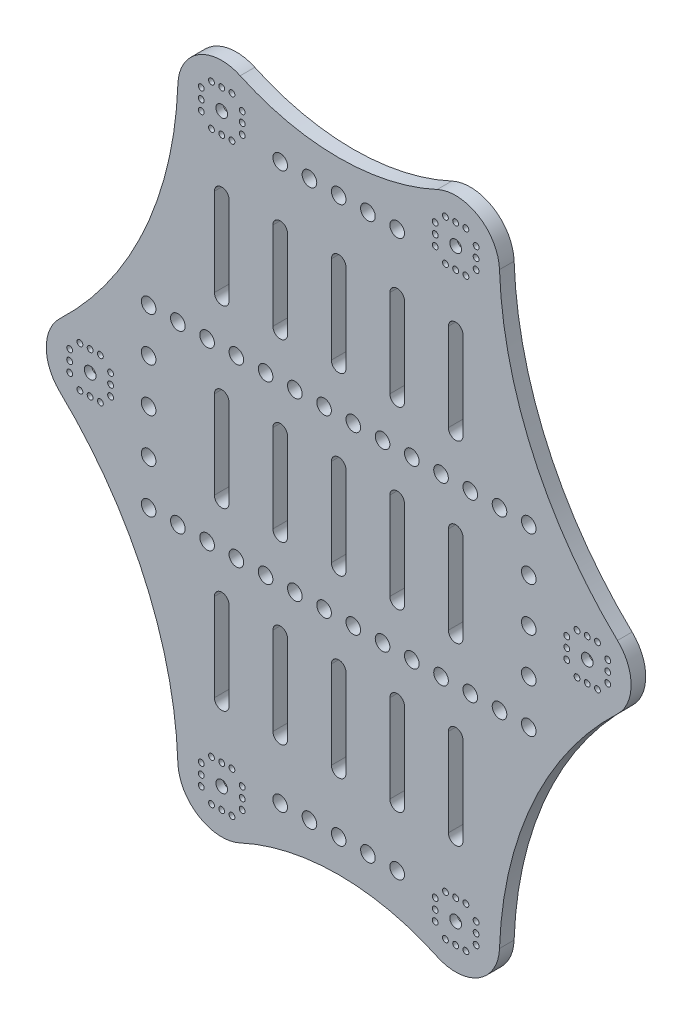
from build123d import *

# Parameters (mm, degrees)
BOSS_EXTRUDE1_DEPTH       = 5
SKETCH2_R                 = 11.25
CUT_EXTRUDE1_DEPTH        = 2.5
SKETCH3_R                 = 1
SKETCH3_R_2               = 2
CUT_EXTRUDE2_DEPTH        = 2.5
MIRROR2_COPY_1_SKETCH_R   = 1
MIRROR2_COPY_1_SKETCH_R_2 = 2
MIRROR2_COPY_1_DEPTH      = 2.5
SKETCH5_R                 = 2.5
CUT_EXTRUDE4_DEPTH        = 12.5
CUT_EXTRUDE6_DEPTH        = 10
SKETCH9_R                 = 2.5
CUT_EXTRUDE7_DEPTH        = 10
SKETCH10_R                = 2.5
CUT_EXTRUDE8_DEPTH        = 10


with BuildPart() as part:
    # Sketch1 → Boss-Extrude1 (new body)
    with BuildSketch(Plane.XY):
        with BuildLine():
            ThreePointArc((95.335601491, -10.870848257), (100, 0), (95.335601491, 10.870848257))
            ThreePointArc((95.335601491, 10.870848257), (66.361018737, 51.737458432), (54.990773904, 100.526020671))
            ThreePointArc((54.990773904, 100.526020671), (47.847440062, 112.783492655), (33.684210526, 113.60554311))
            ThreePointArc((33.684210526, 113.60554311), (0, 106.168439698), (-33.684210526, 113.60554311))
            ThreePointArc((-33.684210526, 113.60554311), (-47.847440062, 112.783492655), (-54.990773904, 100.526020671))
            ThreePointArc((-54.990773904, 100.526020671), (-66.361018737, 51.737458432), (-95.335601491, 10.870848257))
            ThreePointArc((-95.335601491, 10.870848257), (-100, 0), (-95.335601491, -10.870848257))
            ThreePointArc((-95.335601491, -10.870848257), (-66.361018737, -51.737458432), (-54.990773904, -100.526020671))
            ThreePointArc((-54.990773904, -100.526020671), (-47.847440062, -112.783492655), (-33.684210526, -113.60554311))
            ThreePointArc((-33.684210526, -113.60554311), (0, -106.168439698), (33.684210526, -113.60554311))
            ThreePointArc((33.684210526, -113.60554311), (47.847440062, -112.783492655), (54.990773904, -100.526020671))
            ThreePointArc((54.990773904, -100.526020671), (66.361018737, -51.737458432), (95.335601491, -10.870848257))
        make_face()
    extrude(amount=BOSS_EXTRUDE1_DEPTH)

    # Sketch2 → Cut-Extrude1 (cut)
    with BuildSketch(Plane(origin=(0, 0, 0), x_dir=(-1, 0, 0), z_dir=(0, 0, -1))):
        with Locations((-40, 100)):
            Circle(SKETCH2_R)
        with Locations((-85, 0)):
            Circle(SKETCH2_R)
        with Locations((85, 0)):
            Circle(SKETCH2_R)
        with Locations((40, 100)):
            Circle(SKETCH2_R)
        with Locations((40, -100)):
            Circle(SKETCH2_R)
        with Locations((-40, -100)):
            Circle(SKETCH2_R)
    extrude(amount=-CUT_EXTRUDE1_DEPTH, mode=Mode.SUBTRACT)

    # Sketch3 → Cut-Extrude2 (cut)
    with BuildSketch(Plane(origin=(0, 0, 2.5), x_dir=(-1, 0, 0), z_dir=(0, 0, -1))):
        with Locations((-47, 103.5)):
            Circle(SKETCH3_R)
        with Locations((-47, 100)):
            Circle(SKETCH3_R)
        with Locations((-47, 96.5)):
            Circle(SKETCH3_R)
        with Locations((-40, 100)):
            Circle(SKETCH3_R_2)
        with Locations((-43.5, 93)):
            Circle(SKETCH3_R)
        with Locations((-40, 93)):
            Circle(SKETCH3_R)
        with Locations((-36.5, 93)):
            Circle(SKETCH3_R)
        with Locations((-33, 96.5)):
            Circle(SKETCH3_R)
        with Locations((-33, 100)):
            Circle(SKETCH3_R)
        with Locations((-33, 103.5)):
            Circle(SKETCH3_R)
        with Locations((-36.5, 107)):
            Circle(SKETCH3_R)
        with Locations((-40, 107)):
            Circle(SKETCH3_R)
        with Locations((-43.5, 107)):
            Circle(SKETCH3_R)
        with Locations((-85, -7)):
            Circle(SKETCH3_R)
        with Locations((-85, 0)):
            Circle(SKETCH3_R_2)
        with Locations((-78, 0)):
            Circle(SKETCH3_R)
        with Locations((-85, 0)):
            Circle(SKETCH3_R_2)
        with Locations((-85, 0)):
            Circle(SKETCH3_R_2)
        with Locations((-92, -3.5)):
            Circle(SKETCH3_R)
        with Locations((-92, 0)):
            Circle(SKETCH3_R)
        with Locations((-92, 3.5)):
            Circle(SKETCH3_R)
        with Locations((-88.5, 7)):
            Circle(SKETCH3_R)
        with Locations((-85, 7)):
            Circle(SKETCH3_R)
        with Locations((-81.5, 7)):
            Circle(SKETCH3_R)
        with Locations((-81.5, -7)):
            Circle(SKETCH3_R)
        with Locations((-88.5, -7)):
            Circle(SKETCH3_R)
        with Locations((-78, -3.5)):
            Circle(SKETCH3_R)
        with Locations((-78, 3.5)):
            Circle(SKETCH3_R)
    cut_extrude2 = extrude(amount=-CUT_EXTRUDE2_DEPTH, mode=Mode.SUBTRACT)

    # Mirror1: Cut-Extrude2 across plane
    add(cut_extrude2.mirror(Plane(origin=(0, 0, 0), x_dir=(0, 0, 1), z_dir=(1, 0, 0))), mode=Mode.SUBTRACT)

    # Mirror2: Cut-Extrude2 across plane
    add(cut_extrude2.mirror(Plane.ZX), mode=Mode.SUBTRACT)

    # Mirror2 copy 1 sketch → Mirror2 copy 1 (cut)
    with BuildSketch(Plane(origin=(0, 0, 2.5), x_dir=(1, 0, 0), z_dir=(0, 0, -1))):
        with Locations((-47, 103.5)):
            Circle(MIRROR2_COPY_1_SKETCH_R)
        with Locations((-47, 100)):
            Circle(MIRROR2_COPY_1_SKETCH_R)
        with Locations((-47, 96.5)):
            Circle(MIRROR2_COPY_1_SKETCH_R)
        with Locations((-40, 100)):
            Circle(MIRROR2_COPY_1_SKETCH_R_2)
        with Locations((-43.5, 93)):
            Circle(MIRROR2_COPY_1_SKETCH_R)
        with Locations((-40, 93)):
            Circle(MIRROR2_COPY_1_SKETCH_R)
        with Locations((-36.5, 93)):
            Circle(MIRROR2_COPY_1_SKETCH_R)
        with Locations((-33, 96.5)):
            Circle(MIRROR2_COPY_1_SKETCH_R)
        with Locations((-33, 100)):
            Circle(MIRROR2_COPY_1_SKETCH_R)
        with Locations((-33, 103.5)):
            Circle(MIRROR2_COPY_1_SKETCH_R)
        with Locations((-36.5, 107)):
            Circle(MIRROR2_COPY_1_SKETCH_R)
        with Locations((-40, 107)):
            Circle(MIRROR2_COPY_1_SKETCH_R)
        with Locations((-43.5, 107)):
            Circle(MIRROR2_COPY_1_SKETCH_R)
        with Locations((-85, -7)):
            Circle(MIRROR2_COPY_1_SKETCH_R)
        with Locations((-85, 0)):
            Circle(MIRROR2_COPY_1_SKETCH_R_2)
        with Locations((-78, 0)):
            Circle(MIRROR2_COPY_1_SKETCH_R)
        with Locations((-85, 0)):
            Circle(MIRROR2_COPY_1_SKETCH_R_2)
        with Locations((-85, 0)):
            Circle(MIRROR2_COPY_1_SKETCH_R_2)
        with Locations((-92, -3.5)):
            Circle(MIRROR2_COPY_1_SKETCH_R)
        with Locations((-92, 0)):
            Circle(MIRROR2_COPY_1_SKETCH_R)
        with Locations((-92, 3.5)):
            Circle(MIRROR2_COPY_1_SKETCH_R)
        with Locations((-88.5, 7)):
            Circle(MIRROR2_COPY_1_SKETCH_R)
        with Locations((-85, 7)):
            Circle(MIRROR2_COPY_1_SKETCH_R)
        with Locations((-81.5, 7)):
            Circle(MIRROR2_COPY_1_SKETCH_R)
        with Locations((-81.5, -7)):
            Circle(MIRROR2_COPY_1_SKETCH_R)
        with Locations((-88.5, -7)):
            Circle(MIRROR2_COPY_1_SKETCH_R)
        with Locations((-78, -3.5)):
            Circle(MIRROR2_COPY_1_SKETCH_R)
        with Locations((-78, 3.5)):
            Circle(MIRROR2_COPY_1_SKETCH_R)
    extrude(amount=-MIRROR2_COPY_1_DEPTH, mode=Mode.SUBTRACT)

    # Sketch5 → Cut-Extrude4 (cut)
    with BuildSketch(Plane(origin=(0, 0, 0), x_dir=(-1, 0, 0), z_dir=(0, 0, -1))):
        with Locations((20, 95)):
            Circle(SKETCH5_R)
        with Locations((0, 95)):
            Circle(SKETCH5_R)
        with Locations((10, 95)):
            Circle(SKETCH5_R)
        with Locations((10, -95)):
            Circle(SKETCH5_R)
        with Locations((0, -95)):
            Circle(SKETCH5_R)
        with Locations((20, -95)):
            Circle(SKETCH5_R)
        with Locations((-20, 95)):
            Circle(SKETCH5_R)
        with Locations((-10, 95)):
            Circle(SKETCH5_R)
        with Locations((-20, -95)):
            Circle(SKETCH5_R)
        with Locations((-10, -95)):
            Circle(SKETCH5_R)
    extrude(amount=-CUT_EXTRUDE4_DEPTH, mode=Mode.SUBTRACT)

    # Sketch8 → Cut-Extrude6 (cut)
    with BuildSketch(Plane.XY.offset(5)):
        with BuildLine():
            Line((42.5, 75), (42.5, 45))
            ThreePointArc((42.5, 45), (40, 42.5), (37.5, 45))
            Line((37.5, 45), (37.5, 75))
            ThreePointArc((37.5, 75), (40, 77.5), (42.5, 75))
        make_face()
        with BuildLine():
            Line((22.5, 75), (22.5, 45))
            ThreePointArc((22.5, 45), (20, 42.5), (17.5, 45))
            Line((17.5, 45), (17.5, 75))
            ThreePointArc((17.5, 75), (20, 77.5), (22.5, 75))
        make_face()
        with BuildLine():
            Line((2.5, 75), (2.5, 45))
            ThreePointArc((2.5, 45), (0, 42.5), (-2.5, 45))
            Line((-2.5, 45), (-2.5, 75))
            ThreePointArc((-2.5, 75), (0, 77.5), (2.5, 75))
        make_face()
        with BuildLine():
            Line((-17.5, 75), (-17.5, 45))
            ThreePointArc((-17.5, 45), (-20, 42.5), (-22.5, 45))
            Line((-22.5, 45), (-22.5, 75))
            ThreePointArc((-22.5, 75), (-20, 77.5), (-17.5, 75))
        make_face()
        with BuildLine():
            Line((-37.5, 75), (-37.5, 45))
            ThreePointArc((-37.5, 45), (-40, 42.5), (-42.5, 45))
            Line((-42.5, 45), (-42.5, 75))
            ThreePointArc((-42.5, 75), (-40, 77.5), (-37.5, 75))
        make_face()
        with BuildLine():
            Line((42.5, 15), (42.5, -15))
            ThreePointArc((42.5, -15), (40, -17.5), (37.5, -15))
            Line((37.5, -15), (37.5, 15))
            ThreePointArc((37.5, 15), (40, 17.5), (42.5, 15))
        make_face()
        with BuildLine():
            Line((22.5, 15), (22.5, -15))
            ThreePointArc((22.5, -15), (20, -17.5), (17.5, -15))
            Line((17.5, -15), (17.5, 15))
            ThreePointArc((17.5, 15), (20, 17.5), (22.5, 15))
        make_face()
        with BuildLine():
            Line((2.5, 15), (2.5, -15))
            ThreePointArc((2.5, -15), (0, -17.5), (-2.5, -15))
            Line((-2.5, -15), (-2.5, 15))
            ThreePointArc((-2.5, 15), (0, 17.5), (2.5, 15))
        make_face()
        with BuildLine():
            Line((-17.5, 15), (-17.5, -15))
            ThreePointArc((-17.5, -15), (-20, -17.5), (-22.5, -15))
            Line((-22.5, -15), (-22.5, 15))
            ThreePointArc((-22.5, 15), (-20, 17.5), (-17.5, 15))
        make_face()
        with BuildLine():
            Line((-37.5, 15), (-37.5, -15))
            ThreePointArc((-37.5, -15), (-40, -17.5), (-42.5, -15))
            Line((-42.5, -15), (-42.5, 15))
            ThreePointArc((-42.5, 15), (-40, 17.5), (-37.5, 15))
        make_face()
        with BuildLine():
            Line((42.5, -45), (42.5, -75))
            ThreePointArc((42.5, -75), (40, -77.5), (37.5, -75))
            Line((37.5, -75), (37.5, -45))
            ThreePointArc((37.5, -45), (40, -42.5), (42.5, -45))
        make_face()
        with BuildLine():
            Line((22.5, -45), (22.5, -75))
            ThreePointArc((22.5, -75), (20, -77.5), (17.5, -75))
            Line((17.5, -75), (17.5, -45))
            ThreePointArc((17.5, -45), (20, -42.5), (22.5, -45))
        make_face()
        with BuildLine():
            Line((2.5, -45), (2.5, -75))
            ThreePointArc((2.5, -75), (0, -77.5), (-2.5, -75))
            Line((-2.5, -75), (-2.5, -45))
            ThreePointArc((-2.5, -45), (0, -42.5), (2.5, -45))
        make_face()
        with BuildLine():
            Line((-17.5, -45), (-17.5, -75))
            ThreePointArc((-17.5, -75), (-20, -77.5), (-22.5, -75))
            Line((-22.5, -75), (-22.5, -45))
            ThreePointArc((-22.5, -45), (-20, -42.5), (-17.5, -45))
        make_face()
        with BuildLine():
            Line((-37.5, -45), (-37.5, -75))
            ThreePointArc((-37.5, -75), (-40, -77.5), (-42.5, -75))
            Line((-42.5, -75), (-42.5, -45))
            ThreePointArc((-42.5, -45), (-40, -42.5), (-37.5, -45))
        make_face()
    extrude(amount=-CUT_EXTRUDE6_DEPTH, mode=Mode.SUBTRACT)

    # Sketch9 → Cut-Extrude7 (cut)
    with BuildSketch(Plane.XY.offset(5)):
        with Locations((-65, 30)):
            Circle(SKETCH9_R)
        with Locations((-55, 30)):
            Circle(SKETCH9_R)
        with Locations((-45, 30)):
            Circle(SKETCH9_R)
        with Locations((-35, 30)):
            Circle(SKETCH9_R)
        with Locations((-25, 30)):
            Circle(SKETCH9_R)
        with Locations((-15, 30)):
            Circle(SKETCH9_R)
        with Locations((-5, 30)):
            Circle(SKETCH9_R)
        with Locations((5, 30)):
            Circle(SKETCH9_R)
        with Locations((15, 30)):
            Circle(SKETCH9_R)
        with Locations((25, 30)):
            Circle(SKETCH9_R)
        with Locations((35, 30)):
            Circle(SKETCH9_R)
        with Locations((45, 30)):
            Circle(SKETCH9_R)
        with Locations((55, 30)):
            Circle(SKETCH9_R)
        with Locations((65, 30)):
            Circle(SKETCH9_R)
        with Locations((65, -30)):
            Circle(SKETCH9_R)
        with Locations((55, -30)):
            Circle(SKETCH9_R)
        with Locations((45, -30)):
            Circle(SKETCH9_R)
        with Locations((35, -30)):
            Circle(SKETCH9_R)
        with Locations((25, -30)):
            Circle(SKETCH9_R)
        with Locations((15, -30)):
            Circle(SKETCH9_R)
        with Locations((5, -30)):
            Circle(SKETCH9_R)
        with Locations((-5, -30)):
            Circle(SKETCH9_R)
        with Locations((-15, -30)):
            Circle(SKETCH9_R)
        with Locations((-25, -30)):
            Circle(SKETCH9_R)
        with Locations((-35, -30)):
            Circle(SKETCH9_R)
        with Locations((-45, -30)):
            Circle(SKETCH9_R)
        with Locations((-55, -30)):
            Circle(SKETCH9_R)
        with Locations((-65, -30)):
            Circle(SKETCH9_R)
    extrude(amount=-CUT_EXTRUDE7_DEPTH, mode=Mode.SUBTRACT)

    # Sketch10 → Cut-Extrude8 (cut)
    with BuildSketch(Plane.XY.offset(5)):
        with Locations((-65, 0)):
            Circle(SKETCH10_R)
        with Locations((-65, 15)):
            Circle(SKETCH10_R)
        with Locations((-65, -15)):
            Circle(SKETCH10_R)
        with Locations((65, -15)):
            Circle(SKETCH10_R)
        with Locations((65, 0)):
            Circle(SKETCH10_R)
        with Locations((65, 15)):
            Circle(SKETCH10_R)
    extrude(amount=-CUT_EXTRUDE8_DEPTH, mode=Mode.SUBTRACT)


solid = part.part
